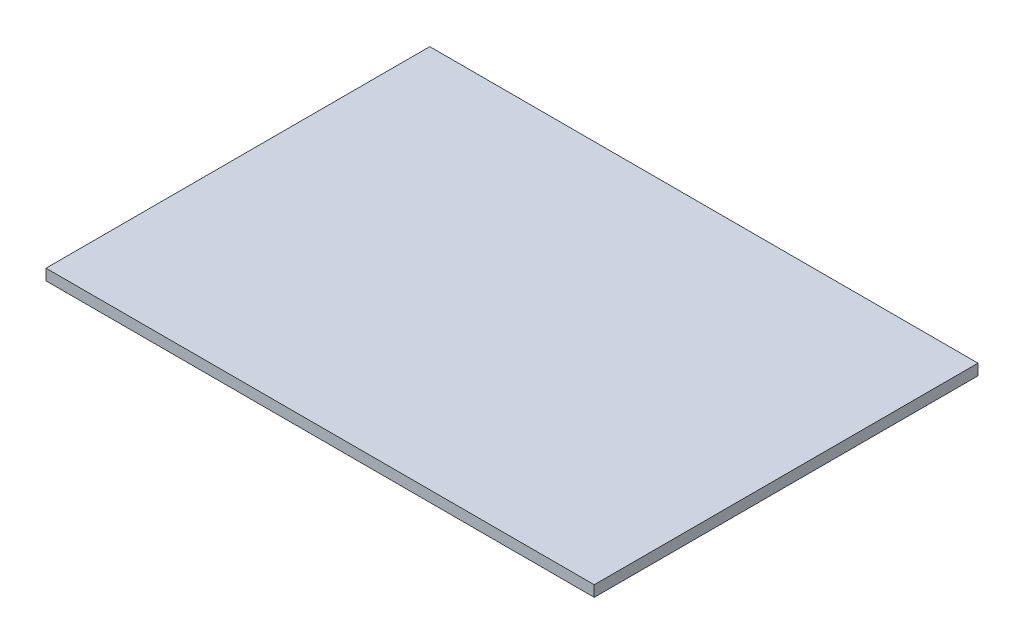
from build123d import *

# Parameters (mm, degrees)
SKETCH1_W           = 50
SKETCH1_H           = 35
BOSS_EXTRUDE1_DEPTH = 1


with BuildPart() as part:
    # Sketch1 → Boss-Extrude1 (new body)
    with BuildSketch(Plane(origin=(0, 0, 0), x_dir=(1, 0, 0), z_dir=(0, 1, 0))):
        Rectangle(SKETCH1_W, SKETCH1_H)
    extrude(amount=BOSS_EXTRUDE1_DEPTH)


solid = part.part
